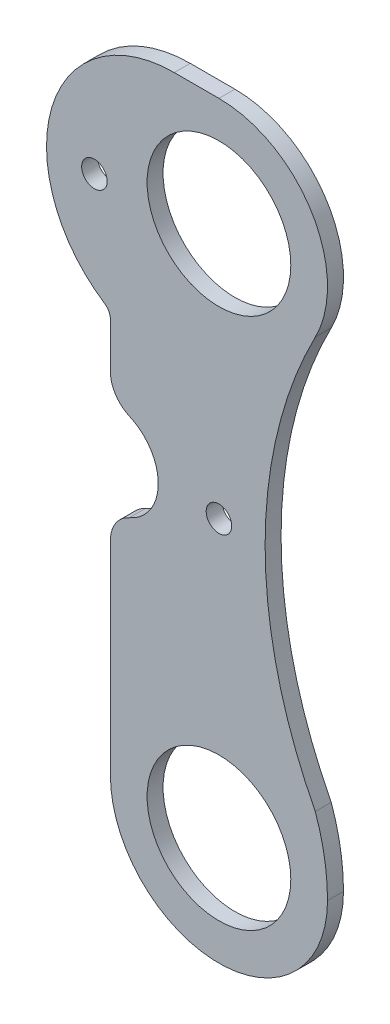
from build123d import *

# Parameters (mm, degrees)
SKETCH1_R            = 14.2875
SKETCH1_R_2          = 2.54
BOSS_EXTRUDE1_DEPTH  = 3.175
CUT_EXTRUDE1_DEPTH   = 162.674043733
FILLET3_R            = 6.35
BOSS_EXTRUDE3_START  = -3.175
SKETCH3_R            = 2.54
BOSS_EXTRUDE3_DEPTH  = 3.175
SKETCH6_R            = 2.54
BOSS_EXTRUDE4_DEPTH  = 3.175
FILLET2_R            = 6.35
CUT_EXTRUDE2_DEPTH   = 168.423732074
CUT_EXTRUDE3_DEPTH   = 168.423732074
CUT_EXTRUDE4_DEPTH   = 168.265702461
BOSS_EXTRUDE8_START  = -3.175
SKETCH15_R           = 2.54
BOSS_EXTRUDE8_DEPTH  = 3.175
FILLET4_R            = 2.54
BOSS_EXTRUDE9_DEPTH  = 3.175
SKETCH17_R           = 14.2875
BOSS_EXTRUDE10_DEPTH = 3.175
CUT_EXTRUDE5_DEPTH   = 132.939082706
SKETCH20_R           = 14.2875
CUT_EXTRUDE6_DEPTH   = 132.939082706


with BuildPart() as part:
    # Sketch1 → Boss-Extrude1 (new body)
    with BuildSketch(Plane.XY):
        with BuildLine():
            Line((-8.89, 25.4), (8.89, 25.4))
            ThreePointArc((8.89, 25.4), (17.870256121, 21.680256121), (21.59, 12.7))
            Line((21.59, 12.7), (21.59, -117.775079775))
            ThreePointArc((21.59, -117.775079775), (21.127743647, -120.388718212), (19.797058824, -122.685251408))
            Line((19.797058824, -122.685251408), (-7.952696208, -155.616779465))
            ThreePointArc((-7.952696208, -155.616779465), (-12.268297602, -157.851943494), (-16.900388255, -156.380852124))
            Line((-16.900388255, -156.380852124), (-32.439211784, -143.287061102))
            ThreePointArc((-32.439211784, -143.287061102), (-34.674375812, -138.971459708), (-33.203284443, -134.339369055))
            Line((-33.203284443, -134.339369055), (-23.382941176, -122.685251408))
            ThreePointArc((-23.382941176, -122.685251408), (-22.052256353, -120.388718212), (-21.59, -117.775079775))
            Line((-21.59, -117.775079775), (-21.59, 12.7))
            ThreePointArc((-21.59, 12.7), (-17.870256121, 21.680256121), (-8.89, 25.4))
        make_face()
        Circle(SKETCH1_R, mode=Mode.SUBTRACT)
        with Locations((0, -101.6)):
            Circle(SKETCH1_R, mode=Mode.SUBTRACT)
        with Locations((-18.532085478, -142.550133084)):
            Circle(SKETCH1_R_2, mode=Mode.SUBTRACT)
        with Locations((0, -50.8)):
            Circle(SKETCH1_R_2, mode=Mode.SUBTRACT)
    extrude(amount=BOSS_EXTRUDE1_DEPTH)

    # Sketch2 → Cut-Extrude1 (cut, through all)
    with BuildSketch(Plane.XY):
        with BuildLine():
            ThreePointArc((19.159083004, -91.647229609), (9.182340769, -50.8), (19.159083004, -9.952770391))
            ThreePointArc((19.159083004, -9.952770391), (20.973467787, -5.122670102), (21.59, 0))
            Line((21.59, 0), (27.94, 0))
            Line((27.94, 0), (27.94, -121.656687185))
            Line((27.94, -121.656687185), (-7.789552878, -164.05809836))
            Line((-7.789552878, -164.05809836), (-17.501317584, -155.874478972))
            Line((-17.501317584, -155.874478972), (16.51, -115.512152961))
            ThreePointArc((16.51, -115.512152961), (20.280273667, -109.005308906), (21.59, -101.6))
            ThreePointArc((21.59, -101.6), (20.973467787, -96.477329898), (19.159083004, -91.647229609))
        make_face()
        with BuildLine():
            Line((-21.59, -41.275), (-21.59, -60.325))
            ThreePointArc((-21.59, -60.325), (-12.065, -50.8), (-21.59, -41.275))
        make_face()
    extrude(amount=CUT_EXTRUDE1_DEPTH, mode=Mode.SUBTRACT)

    # Fillet3
    fillet3_edges = [part.edges().sort_by_distance(p)[0] for p in [
        (-21.59, -41.275, 1.5875),
        (-21.59, -60.325, 1.5875),
    ]]
    fillet(fillet3_edges, radius=FILLET3_R)

    # Sketch3 → Boss-Extrude3 (add)
    with BuildSketch(Plane.XY.offset(3.175).offset(BOSS_EXTRUDE3_START)):
        with BuildLine():
            Line((-27.351416194, -127.394768527), (-36.025496499, -137.688579))
            ThreePointArc((-36.025496499, -137.688579), (-37.217489152, -141.441859142), (-35.4063854, -144.93869507))
            Line((-35.4063854, -144.93869507), (-24.403104784, -154.210610454))
            ThreePointArc((-24.403104784, -154.210610454), (-19.771014132, -155.681701823), (-15.455412737, -153.446537795))
            Line((-15.455412737, -153.446537795), (-7.557639641, -144.073996091))
            Line((-7.557639641, -144.073996091), (-27.351416194, -127.394768527))
        make_face()
        with Locations((-18.532085478, -142.550133084)):
            Circle(SKETCH3_R, mode=Mode.SUBTRACT)
    extrude(amount=BOSS_EXTRUDE3_DEPTH)

    # Sketch6 → Boss-Extrude4 (add)
    with BuildSketch(Plane.XY.offset(3.175)):
        Polygon((-35.4063854, -144.93869507), (-63.620410749, -121.164144113), (-51.344981666, -106.596497054), (-27.065569901, -127.055545526), align=None)
        with Locations((-52.626813855, -117.972130278)):
            Circle(SKETCH6_R, mode=Mode.SUBTRACT)
    extrude(amount=-BOSS_EXTRUDE4_DEPTH)

    # Fillet2
    fillet2_edges = [part.edges().sort_by_distance(p)[0] for p in [
        (-63.620410749, -121.164144113, 1.5875),
        (-51.344981666, -106.596497054, 1.5875),
        (-27.065569901, -127.055545526, 1.5875),
    ]]
    fillet(fillet2_edges, radius=FILLET2_R)

    # Sketch7 → Cut-Extrude2 (cut, through all)
    with BuildSketch(Plane.XY.offset(3.175)):
        with BuildLine():
            Line((-21.59, 0), (-21.59, 31.75))
            Line((-21.59, 31.75), (21.59, 31.75))
            Line((21.59, 31.75), (21.59, 0))
            ThreePointArc((21.59, 0), (0, 21.59), (-21.59, 0))
        make_face()
    extrude(amount=-CUT_EXTRUDE2_DEPTH, mode=Mode.SUBTRACT)

    # Sketch10 → Cut-Extrude3 (cut, through all)
    with BuildSketch(Plane.XY.offset(3.175)):
        with BuildLine():
            Line((-18.151882461, -155.32628042), (-17.361482582, -157.512020269))
            Line((-17.361482582, -157.512020269), (-14.375706423, -156.432313955))
            Line((-14.375706423, -156.432313955), (-15.455412737, -153.446537795))
            ThreePointArc((-15.455412737, -153.446537795), (-16.679911193, -154.563907595), (-18.151882461, -155.32628042))
        make_face()
    extrude(amount=-CUT_EXTRUDE3_DEPTH, mode=Mode.SUBTRACT)

    # Sketch12 → Cut-Extrude4 (cut, through all)
    with BuildSketch(Plane.XY.offset(3.175)):
        with BuildLine():
            Line((-21.59, -101.6), (-72.39, -101.6))
            Line((-72.39, -101.6), (-72.39, -165.1))
            Line((-72.39, -165.1), (16.51, -165.1))
            Line((16.51, -165.1), (16.51, -115.512152961))
            ThreePointArc((16.51, -115.512152961), (-7.405308906, -121.880273667), (-21.59, -101.6))
        make_face()
    extrude(amount=-CUT_EXTRUDE4_DEPTH, mode=Mode.SUBTRACT)

    # Sketch15 → Boss-Extrude8 (add)
    with BuildSketch(Plane.XY.offset(3.175).offset(BOSS_EXTRUDE8_START)):
        with BuildLine():
            ThreePointArc((-34.29, -3.81), (-30.887045256, -16.51), (-21.59, -25.807045256))
            Line((-21.59, -25.807045256), (-21.59, 0))
            ThreePointArc((-21.59, 0), (-15.266435406, 15.266435406), (0, 21.59))
            Line((0, 21.59), (-8.89, 21.59))
            ThreePointArc((-8.89, 21.59), (-26.850512242, 14.150512242), (-34.29, -3.81))
        make_face()
        with Locations((-24.765, -3.81)):
            Circle(SKETCH15_R, mode=Mode.SUBTRACT)
    extrude(amount=BOSS_EXTRUDE8_DEPTH)

    # Fillet4
    fillet4_edges = [part.edges().sort_by_distance(p)[0] for p in [
        (-21.59, -25.807045256, 1.5875),
    ]]
    fillet(fillet4_edges, radius=FILLET4_R)

    # Sketch16 → Boss-Extrude9 (add, through all)
    with BuildSketch(Plane.XY.offset(3.175)):
        with BuildLine():
            Line((-21.59, -101.6), (-21.59, -105.77576))
            ThreePointArc((-21.59, -105.77576), (0, -127.36576), (21.59, -105.77576))
            Line((21.59, -105.77576), (21.59, -101.6))
            Line((21.59, -101.6), (4.517920132, -121.700477095))
            Line((4.517920132, -121.700477095), (-1.489522905, -121.700477095))
            Line((-1.489522905, -121.700477095), (-21.59, -101.6))
        make_face()
    extrude(amount=-BOSS_EXTRUDE9_DEPTH)

    # Sketch17 → Boss-Extrude10 (add, through all)
    with BuildSketch(Plane.XY.offset(3.175)):
        with Locations((0, -101.6)):
            Circle(SKETCH17_R)
    extrude(amount=-BOSS_EXTRUDE10_DEPTH)

    # Sketch19 → Cut-Extrude5 (cut, through all)
    with BuildSketch(Plane.XY.offset(3.175)):
        with BuildLine():
            Line((19.159083004, -91.647229609), (21.59, -91.647229609))
            Line((21.59, -91.647229609), (21.59, -105.77576))
            ThreePointArc((21.59, -105.77576), (20.977838358, -98.607693167), (19.159083004, -91.647229609))
        make_face()
    extrude(amount=-CUT_EXTRUDE5_DEPTH, mode=Mode.SUBTRACT)

    # Sketch20 → Cut-Extrude6 (cut, through all)
    with BuildSketch(Plane.XY.offset(3.175)):
        with Locations((0, -105.77576)):
            Circle(SKETCH20_R)
    extrude(amount=-CUT_EXTRUDE6_DEPTH, mode=Mode.SUBTRACT)


solid = part.part
